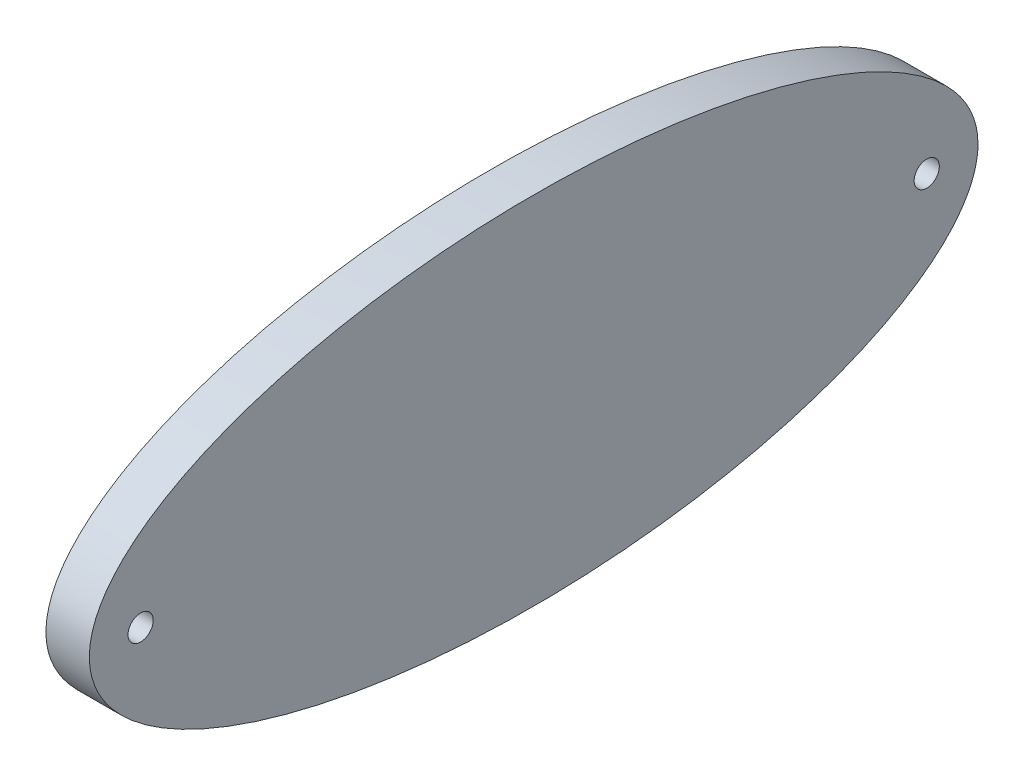
from build123d import *

# Parameters (mm, degrees)
SKETCH1_RX          = 52
SKETCH1_RY          = 20.85
SKETCH1_R           = 1.4732
BOSS_EXTRUDE1_DEPTH = 5.08


with BuildPart() as part:
    # Sketch1 → Boss-Extrude1 (new body)
    with BuildSketch(Plane(origin=(0, 0, 0), x_dir=(0, 0, -1), z_dir=(1, 0, 0))):
        with Locations((0, 0)):
            Ellipse(SKETCH1_RX, SKETCH1_RY)
        with Locations((-46, 0)):
            Circle(SKETCH1_R, mode=Mode.SUBTRACT)
        with Locations((46, 0)):
            Circle(SKETCH1_R, mode=Mode.SUBTRACT)
    extrude(amount=BOSS_EXTRUDE1_DEPTH)


solid = part.part
